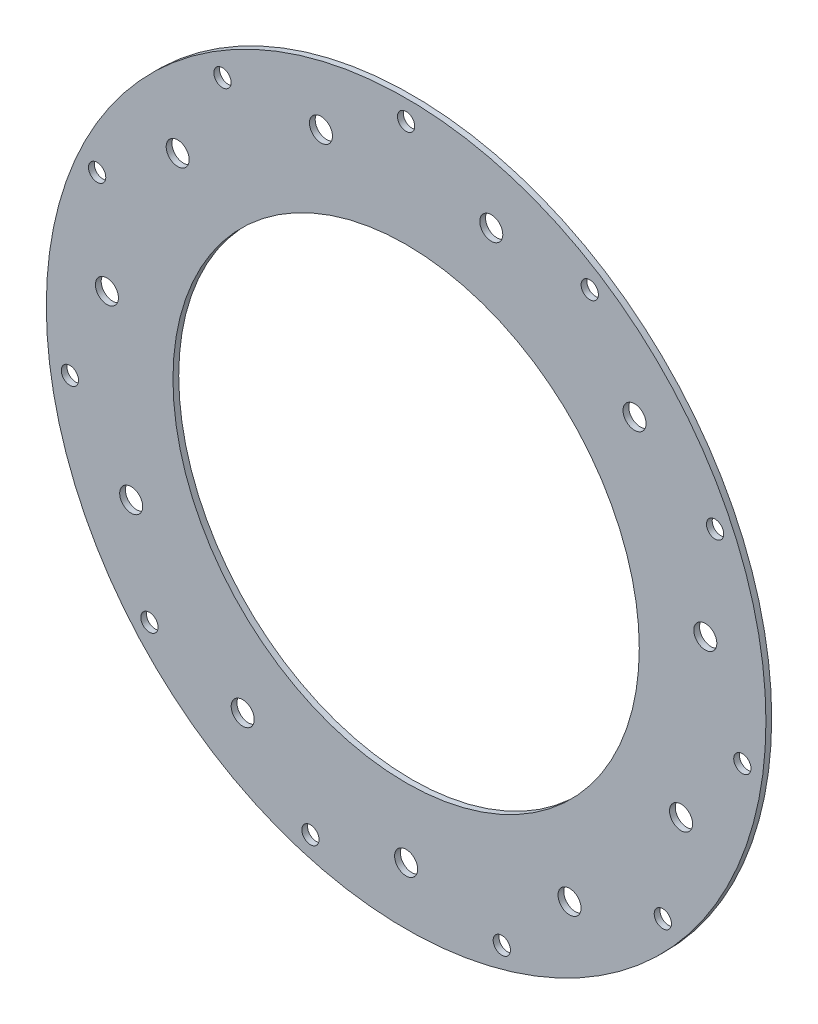
from build123d import *

# Parameters (mm, degrees)
SKETCH_1_R      = 62.5
SKETCH_1_R_2    = 40.5
SKETCH_1_R_3    = 2
SKETCH_1_R_4    = 1.5
EXTRUDE_1_DEPTH = 1


with BuildPart() as part:
    # 草图1 → 凸台-拉伸1 (new body)
    with BuildSketch(Plane.XY):
        Circle(SKETCH_1_R)
        Circle(SKETCH_1_R_2, mode=Mode.SUBTRACT)
        with Locations((0, -52.5)):
            Circle(SKETCH_1_R_3, mode=Mode.SUBTRACT)
        with Locations((-28.383642916, -44.165810474)):
            Circle(SKETCH_1_R_3, mode=Mode.SUBTRACT)
        with Locations((-47.755679756, -21.809288183)):
            Circle(SKETCH_1_R_3, mode=Mode.SUBTRACT)
        with Locations((-51.965625699, 7.471529009)):
            Circle(SKETCH_1_R_3, mode=Mode.SUBTRACT)
        with Locations((-39.676852654, 34.380188532)):
            Circle(SKETCH_1_R_3, mode=Mode.SUBTRACT)
        with Locations((-14.790959234, 50.373381115)):
            Circle(SKETCH_1_R_3, mode=Mode.SUBTRACT)
        with Locations((14.790959234, 50.373381115)):
            Circle(SKETCH_1_R_3, mode=Mode.SUBTRACT)
        with Locations((39.676852654, 34.380188532)):
            Circle(SKETCH_1_R_3, mode=Mode.SUBTRACT)
        with Locations((51.965625699, 7.471529009)):
            Circle(SKETCH_1_R_3, mode=Mode.SUBTRACT)
        with Locations((47.755679756, -21.809288183)):
            Circle(SKETCH_1_R_3, mode=Mode.SUBTRACT)
        with Locations((28.383642916, -44.165810474)):
            Circle(SKETCH_1_R_3, mode=Mode.SUBTRACT)
        with Locations((-16.622220854, -56.610085443)):
            Circle(SKETCH_1_R_4, mode=Mode.SUBTRACT)
        with Locations((-44.589224887, -38.636783303)):
            Circle(SKETCH_1_R_4, mode=Mode.SUBTRACT)
        with Locations((-58.399465071, -8.396575458)):
            Circle(SKETCH_1_R_4, mode=Mode.SUBTRACT)
        with Locations((-53.668287726, 24.509485767)):
            Circle(SKETCH_1_R_4, mode=Mode.SUBTRACT)
        with Locations((-31.89780823, 49.633958437)):
            Circle(SKETCH_1_R_4, mode=Mode.SUBTRACT)
        with Locations((0, 59)):
            Circle(SKETCH_1_R_4, mode=Mode.SUBTRACT)
        with Locations((31.89780823, 49.633958437)):
            Circle(SKETCH_1_R_4, mode=Mode.SUBTRACT)
        with Locations((53.668287726, 24.509485767)):
            Circle(SKETCH_1_R_4, mode=Mode.SUBTRACT)
        with Locations((58.399465071, -8.396575458)):
            Circle(SKETCH_1_R_4, mode=Mode.SUBTRACT)
        with Locations((44.589224887, -38.636783303)):
            Circle(SKETCH_1_R_4, mode=Mode.SUBTRACT)
        with Locations((16.622220854, -56.610085443)):
            Circle(SKETCH_1_R_4, mode=Mode.SUBTRACT)
    extrude(amount=EXTRUDE_1_DEPTH)


solid = part.part
